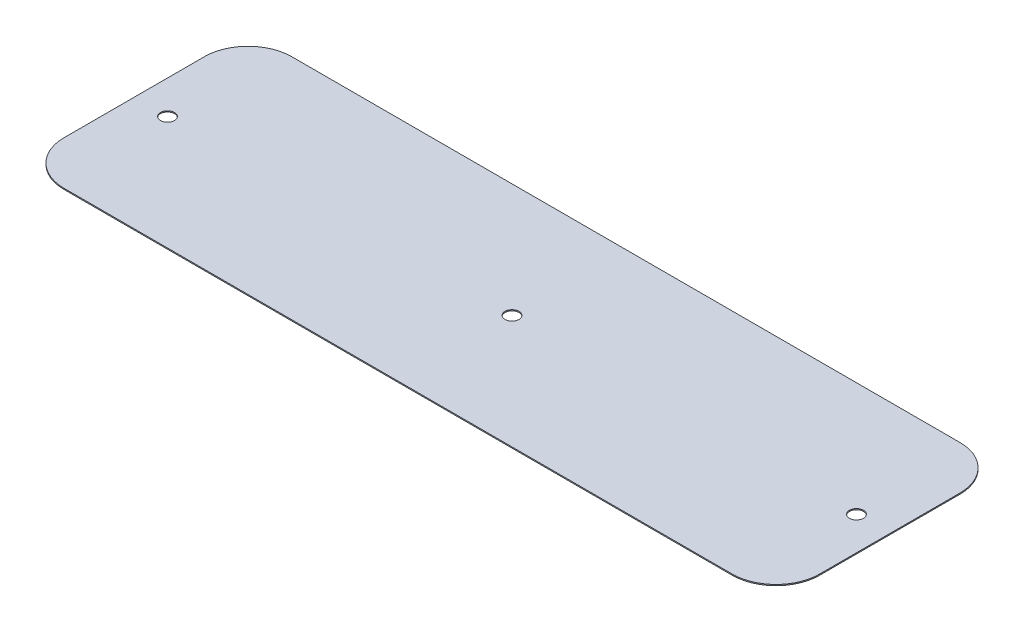
from build123d import *

# Parameters (mm, degrees)
SKETCH1_W           = 172.72
SKETCH1_H           = 52.07
BOSS_EXTRUDE1_DEPTH = 0.25
FILLET1_R           = 10
SKETCH2_R           = 1.6
CUT_EXTRUDE1_DEPTH  = 91.199408673


with BuildPart() as part:
    # Sketch1 → Boss-Extrude1 (new body)
    with BuildSketch(Plane(origin=(0, 0, 0), x_dir=(1, 0, 0), z_dir=(0, 1, 0))):
        Rectangle(SKETCH1_W, SKETCH1_H)
    extrude(amount=BOSS_EXTRUDE1_DEPTH)

    # Fillet1
    fillet1_edges = [part.edges().sort_by_distance(p)[0] for p in [
        (86.36, 0.125, 26.035),
        (-86.36, 0.125, 26.035),
        (-86.36, 0.125, -26.035),
        (86.36, 0.125, -26.035),
    ]]
    fillet(fillet1_edges, radius=FILLET1_R)

    # Sketch2 → Cut-Extrude1 (cut, through all)
    with BuildSketch(Plane(origin=(0, 0.25, 0), x_dir=(1, 0, 0), z_dir=(0, 1, 0))):
        with Locations(Location((-78.74, 0, 0), (0, 0, 270))):
            Circle(SKETCH2_R)
        with Locations(Location((0, 0, 0), (0, 0, 270))):
            Circle(SKETCH2_R)
    cut_extrude1 = extrude(amount=-CUT_EXTRUDE1_DEPTH, mode=Mode.SUBTRACT)

    # Mirror1: Cut-Extrude1 across plane
    add(cut_extrude1.mirror(Plane(origin=(0, 0, 0), x_dir=(0, 0, 1), z_dir=(1, 0, 0))), mode=Mode.SUBTRACT)


solid = part.part
